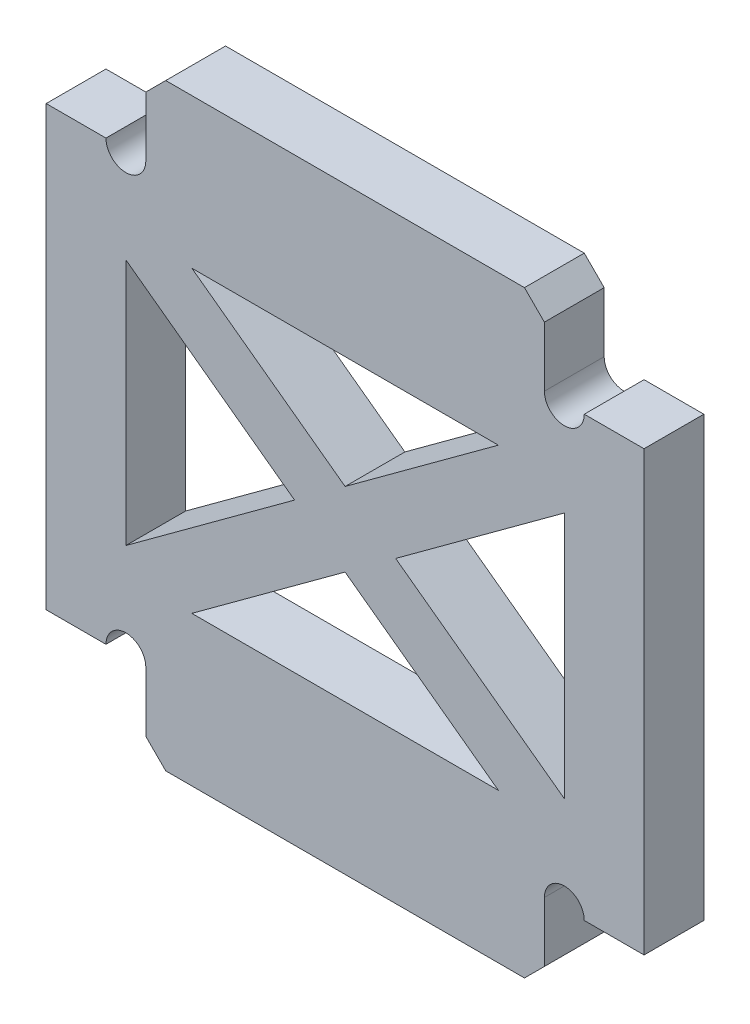
from build123d import *

# Parameters (mm, degrees)
EXTRUDE_1_DEPTH = 1.5
CHAMFER_1_SIZE  = 1


with BuildPart() as part:
    # 草图1 → 凸台-拉伸1 (new, symmetric)
    with BuildSketch(Plane.XY):
        with BuildLine():
            Line((-10, 15), (-10, 11))
            ThreePointArc((-10, 11), (-11, 10), (-12, 11))
            Line((-12, 11), (-15, 11))
            Line((-15, 11), (-15, -11))
            Line((-15, -11), (-12, -11))
            ThreePointArc((-12, -11), (-11, -10), (-10, -11))
            Line((-10, -11), (-10, -15))
            Line((-10, -15), (10, -15))
            Line((10, -15), (10, -11))
            ThreePointArc((10, -11), (11, -10), (12, -11))
            Line((12, -11), (15, -11))
            Line((15, -11), (15, 11))
            Line((15, 11), (12, 11))
            ThreePointArc((12, 11), (11, 10), (10, 11))
            Line((10, 11), (10, 15))
            Line((10, 15), (-10, 15))
        make_face()
        Polygon((2.53651026, 0), (11, 6.206559143), (11, -6.206559143), align=None, mode=Mode.SUBTRACT)
        Polygon((0, -1.860107524), (7.690762468, -7.5), (-7.690762468, -7.5), align=None, mode=Mode.SUBTRACT)
        Polygon((-11, 6.206559143), (-2.53651026, 0), (-11, -6.206559143), align=None, mode=Mode.SUBTRACT)
        Polygon((-7.690762468, 7.5), (7.690762468, 7.5), (0, 1.860107524), align=None, mode=Mode.SUBTRACT)
    extrude(amount=EXTRUDE_1_DEPTH, both=True)

    # 倒角1
    chamfer_1_edges = [part.edges().sort_by_distance(p)[0] for p in [
        (-10, 15, 0),
        (10, 15, 0),
        (10, -15, 0),
        (-10, -15, 0),
    ]]
    chamfer(chamfer_1_edges, length=CHAMFER_1_SIZE)


solid = part.part
